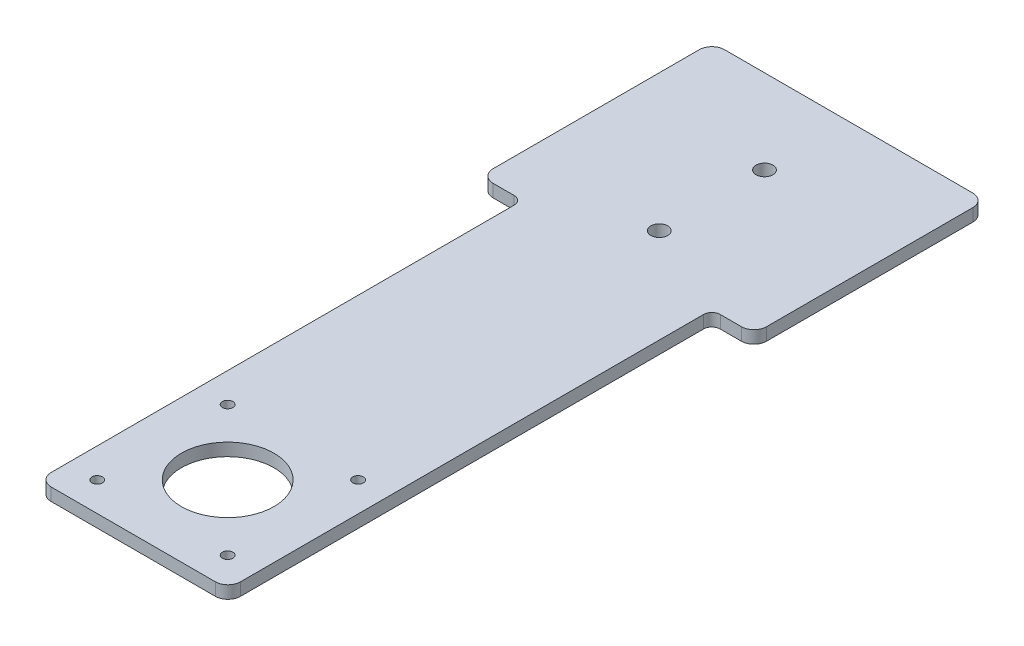
from build123d import *

# Parameters (mm, degrees)
SKETCH1_R           = 2
SKETCH1_R_2         = 1.25
SKETCH1_R_3         = 11
BOSS_EXTRUDE1_DEPTH = 3
FILLET1_R           = 3
FILLET2_R           = 3
FILLET3_R           = 3
FILLET4_R           = 3
FILLET5_R           = 3
FILLET7_R           = 3
FILLET8_R           = 2
FILLET9_R           = 2


with BuildPart() as part:
    # Sketch1 → Boss-Extrude1 (new body)
    with BuildSketch(Plane(origin=(0, 0, 0), x_dir=(1, 0, 0), z_dir=(0, 1, 0))):
        Polygon((0, 111.61362417), (-32.5, 111.61362417), (-32.5, 56.61362417), (-22.5, 56.61362417), (-22.5, -58.38637583), (0, -58.38637583), (22.5, -58.38637583), (22.5, 56.61362417), (32.5, 56.61362417), (32.5, 111.61362417), align=None)
        with Locations(Location((0, 91.61362417, 0), (0, 0, 270))):
            Circle(SKETCH1_R, mode=Mode.SUBTRACT)
        with Locations(Location((0, 66.61362417, 0), (0, 0, 270))):
            Circle(SKETCH1_R, mode=Mode.SUBTRACT)
        with Locations(Location((-15.5, -20.454039675, 0), (0, 0, 270))):
            Circle(SKETCH1_R_2, mode=Mode.SUBTRACT)
        with Locations(Location((-15.5, -51.454039675, 0), (0, 0, 270))):
            Circle(SKETCH1_R_2, mode=Mode.SUBTRACT)
        with Locations(Location((15.5, -51.454039675, 0), (0, 0, 270))):
            Circle(SKETCH1_R_2, mode=Mode.SUBTRACT)
        with Locations(Location((15.5, -20.454039675, 0), (0, 0, 270))):
            Circle(SKETCH1_R_2, mode=Mode.SUBTRACT)
        with Locations(Location((0, -35.954039675, 0), (0, 0, 270))):
            Circle(SKETCH1_R_3, mode=Mode.SUBTRACT)
    extrude(amount=BOSS_EXTRUDE1_DEPTH)

    # Fillet1
    fillet1_edges = [part.edges().sort_by_distance(p)[0] for p in [
        (32.5, 1.5, -111.61362417),
    ]]
    fillet(fillet1_edges, radius=FILLET1_R)

    # Fillet2
    fillet2_edges = [part.edges().sort_by_distance(p)[0] for p in [
        (-32.5, 1.5, -111.61362417),
    ]]
    fillet(fillet2_edges, radius=FILLET2_R)

    # Fillet3
    fillet3_edges = [part.edges().sort_by_distance(p)[0] for p in [
        (-32.5, 1.5, -56.61362417),
    ]]
    fillet(fillet3_edges, radius=FILLET3_R)

    # Fillet4
    fillet4_edges = [part.edges().sort_by_distance(p)[0] for p in [
        (32.5, 1.5, -56.61362417),
    ]]
    fillet(fillet4_edges, radius=FILLET4_R)

    # Fillet5
    fillet5_edges = [part.edges().sort_by_distance(p)[0] for p in [
        (22.5, 1.5, 58.38637583),
    ]]
    fillet(fillet5_edges, radius=FILLET5_R)

    # Fillet7
    fillet7_edges = [part.edges().sort_by_distance(p)[0] for p in [
        (-22.5, 1.5, 58.38637583),
    ]]
    fillet(fillet7_edges, radius=FILLET7_R)

    # Fillet8
    fillet8_edges = [part.edges().sort_by_distance(p)[0] for p in [
        (-22.5, 1.5, -56.61362417),
    ]]
    fillet(fillet8_edges, radius=FILLET8_R)

    # Fillet9
    fillet9_edges = [part.edges().sort_by_distance(p)[0] for p in [
        (22.5, 1.5, -56.61362417),
    ]]
    fillet(fillet9_edges, radius=FILLET9_R)


solid = part.part
